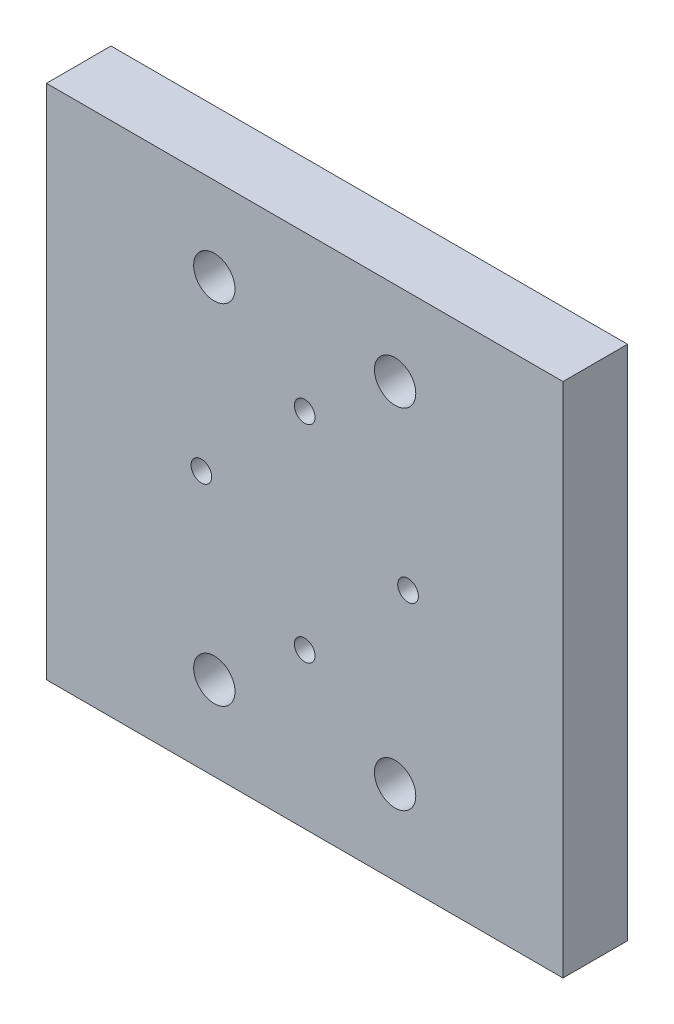
from build123d import *

# Parameters (mm, degrees)
SKETCH1_W           = 40
SKETCH1_H           = 40
SKETCH1_R           = 0.8
SKETCH1_R_2         = 1.6
BOSS_EXTRUDE1_DEPTH = 5


with BuildPart() as part:
    # Sketch1 → Boss-Extrude1 (new body)
    with BuildSketch(Plane.XY):
        Rectangle(SKETCH1_W, SKETCH1_H)
        with Locations((0, 8)):
            Circle(SKETCH1_R, mode=Mode.SUBTRACT)
        with Locations((-8, 0)):
            Circle(SKETCH1_R, mode=Mode.SUBTRACT)
        with Locations((8, 0)):
            Circle(SKETCH1_R, mode=Mode.SUBTRACT)
        with Locations((0, -8)):
            Circle(SKETCH1_R, mode=Mode.SUBTRACT)
        with Locations((7, 13.5)):
            Circle(SKETCH1_R_2, mode=Mode.SUBTRACT)
        with Locations((-7, 13.5)):
            Circle(SKETCH1_R_2, mode=Mode.SUBTRACT)
        with Locations((7, -13.5)):
            Circle(SKETCH1_R_2, mode=Mode.SUBTRACT)
        with Locations((-7, -13.5)):
            Circle(SKETCH1_R_2, mode=Mode.SUBTRACT)
    extrude(amount=BOSS_EXTRUDE1_DEPTH)


solid = part.part
